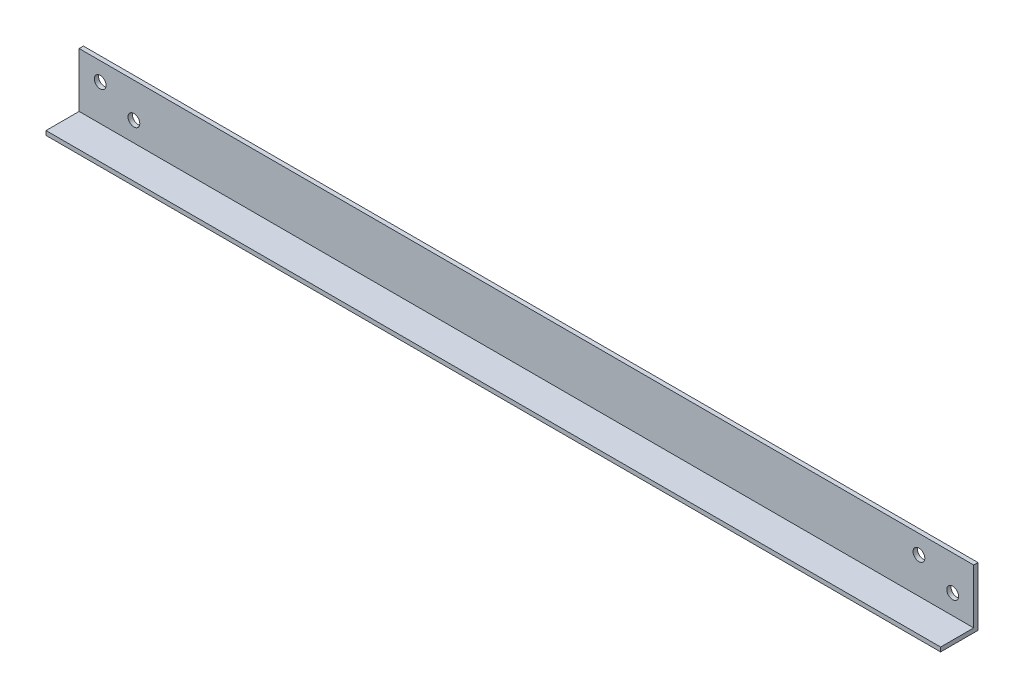
from build123d import *

# Parameters (mm, degrees)
SKETCH_1_W          = 1675
SKETCH_1_H          = 110
EXTRUDE_1_DEPTH     = 8
SKETCH_2_W          = 1675
SKETCH_2_H          = 8
EXTRUDE_2_DEPTH     = 62
SKETCH_3_R          = 11
CUT_EXTRUDE_1_DEPTH = 1681.066962951


with BuildPart() as part:
    # 草图1 → 拉伸1 (new body)
    with BuildSketch(Plane.XY):
        with Locations((837.5, 55)):
            Rectangle(SKETCH_1_W, SKETCH_1_H)
    extrude(amount=EXTRUDE_1_DEPTH)

    # 草图2 → 拉伸2 (add)
    with BuildSketch(Plane.XY.offset(8)):
        with Locations((837.5, 4)):
            Rectangle(SKETCH_2_W, SKETCH_2_H)
    extrude(amount=EXTRUDE_2_DEPTH)

    # 草图3 → 切除-拉伸1 (cut, through all)
    with BuildSketch(Plane(origin=(0, 0, 0), x_dir=(-1, 0, 0), z_dir=(0, 0, -1))):
        with Locations((-1635.574764315, 45)):
            Circle(SKETCH_3_R)
        with Locations((-1572.407333755, 75.164146207)):
            Circle(SKETCH_3_R)
        with Locations((-102.592666245, 45)):
            Circle(SKETCH_3_R)
        with Locations((-39.425235685, 75.164146207)):
            Circle(SKETCH_3_R)
    extrude(amount=-CUT_EXTRUDE_1_DEPTH, mode=Mode.SUBTRACT)


solid = part.part
